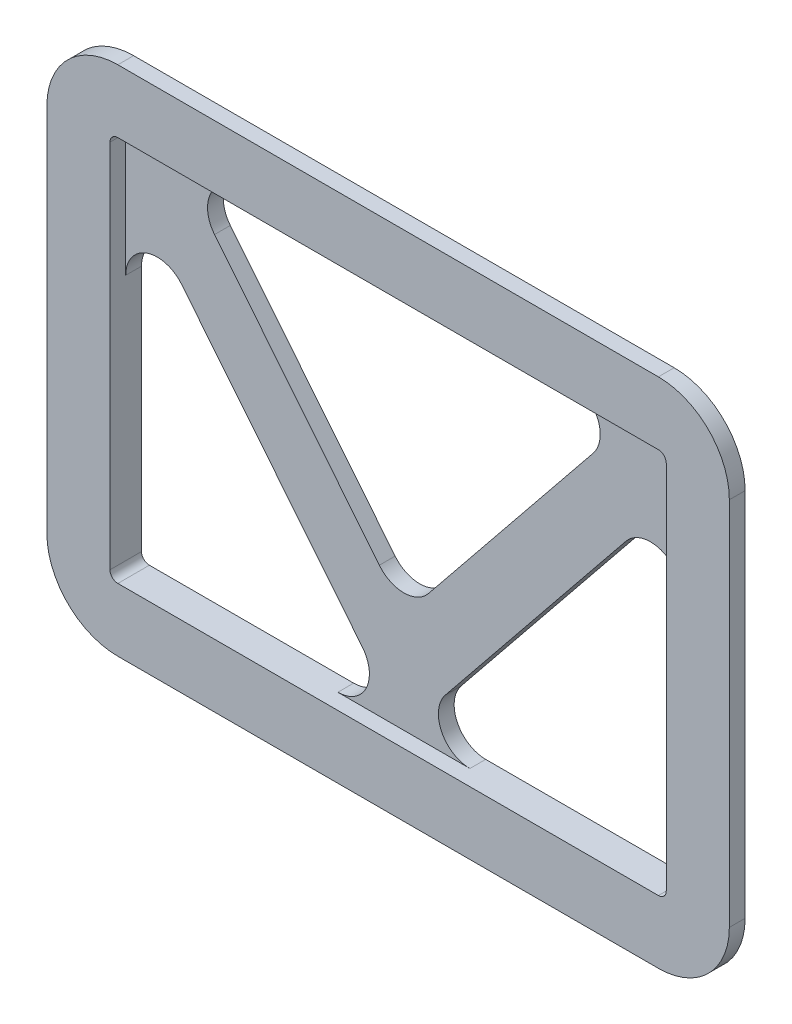
from build123d import *

# Parameters (mm, degrees)
BOSS_EXTRUDE1_DEPTH = 10
BOSS_EXTRUDE2_DEPTH = 10


with BuildPart() as part:
    # Sketch1 → Boss-Extrude1 (new body)
    with BuildSketch(Plane.XY):
        with BuildLine():
            Line((-25, 0), (-25, 234.81313371))
            ThreePointArc((-25, 234.81313371), (-17.67766953, 252.49080324), (0, 259.81313371))
            Line((0, 259.81313371), (342.73755676, 259.81313371))
            ThreePointArc((342.73755676, 259.81313371), (360.415226289, 252.49080324), (367.73755676, 234.81313371))
            Line((367.73755676, 234.81313371), (367.73755676, 0))
            ThreePointArc((367.73755676, 0), (360.415226289, -17.67766953), (342.73755676, -25))
            Line((342.73755676, -25), (0, -25))
            ThreePointArc((0, -25), (-17.67766953, -17.67766953), (-25, 0))
        make_face()
        with BuildLine():
            Line((-5, 0), (-5, 156.717467164))
            ThreePointArc((-5, 156.717467164), (8.334411906, 175.574029293), (30.556993535, 169.286474767))
            Line((30.556993535, 169.286474767), (145.055204149, 27.569007604))
            ThreePointArc((145.055204149, 27.569007604), (147.545096107, 6.37967959), (129.498210613, -5))
            Line((129.498210613, -5), (0, -5))
            ThreePointArc((0, -5), (-3.535533906, -3.535533906), (-5, 0))
        make_face(mode=Mode.SUBTRACT)
        with BuildLine():
            Line((66.870567767, 239.81313371), (275.866988993, 239.81313371))
            ThreePointArc((275.866988993, 239.81313371), (293.913874487, 228.43345412), (291.423982529, 207.244126107))
            Line((291.423982529, 207.244126107), (186.925771915, 77.903923741))
            ThreePointArc((186.925771915, 77.903923741), (171.36877838, 70.472931344), (155.811784844, 77.903923741))
            Line((155.811784844, 77.903923741), (51.313574231, 207.244126107))
            ThreePointArc((51.313574231, 207.244126107), (48.823682273, 228.43345412), (66.870567767, 239.81313371))
        make_face(mode=Mode.SUBTRACT)
        with BuildLine():
            Line((347.73755676, 156.717467164), (347.73755676, 0))
            ThreePointArc((347.73755676, 0), (346.273090666, -3.535533906), (342.73755676, -5))
            Line((342.73755676, -5), (213.239346146, -5))
            ThreePointArc((213.239346146, -5), (195.192460652, 6.37967959), (197.682352611, 27.569007604))
            Line((197.682352611, 27.569007604), (312.180563224, 169.286474767))
            ThreePointArc((312.180563224, 169.286474767), (334.403144854, 175.574029293), (347.73755676, 156.717467164))
        make_face(mode=Mode.SUBTRACT)
    extrude(amount=BOSS_EXTRUDE1_DEPTH)

    # Sketch2 → Boss-Extrude2 (add)
    with BuildSketch(Plane.XY.offset(10)):
        with BuildLine():
            Line((342.73755676, 279.81313371), (0, 279.81313371))
            ThreePointArc((0, 279.81313371), (-31.819805153, 266.632938864), (-45, 234.81313371))
            Line((-45, 234.81313371), (-45, 0))
            ThreePointArc((-45, 0), (-31.819805153, -31.819805153), (0, -45))
            Line((0, -45), (342.73755676, -45))
            ThreePointArc((342.73755676, -45), (374.557361913, -31.819805153), (387.73755676, 0))
            Line((387.73755676, 0), (387.73755676, 234.81313371))
            ThreePointArc((387.73755676, 234.81313371), (374.557361913, 266.632938864), (342.73755676, 279.81313371))
        make_face()
        with BuildLine():
            Line((342.73755676, 239.81313371), (0, 239.81313371))
            ThreePointArc((0, 239.81313371), (-3.535533906, 238.348667616), (-5, 234.81313371))
            Line((-5, 234.81313371), (-5, 0))
            ThreePointArc((-5, 0), (-3.535533906, -3.535533906), (0, -5))
            Line((0, -5), (342.73755676, -5))
            ThreePointArc((342.73755676, -5), (346.273090666, -3.535533906), (347.73755676, 0))
            Line((347.73755676, 0), (347.73755676, 234.81313371))
            ThreePointArc((347.73755676, 234.81313371), (346.273090666, 238.348667616), (342.73755676, 239.81313371))
        make_face(mode=Mode.SUBTRACT)
    extrude(amount=BOSS_EXTRUDE2_DEPTH)


solid = part.part
